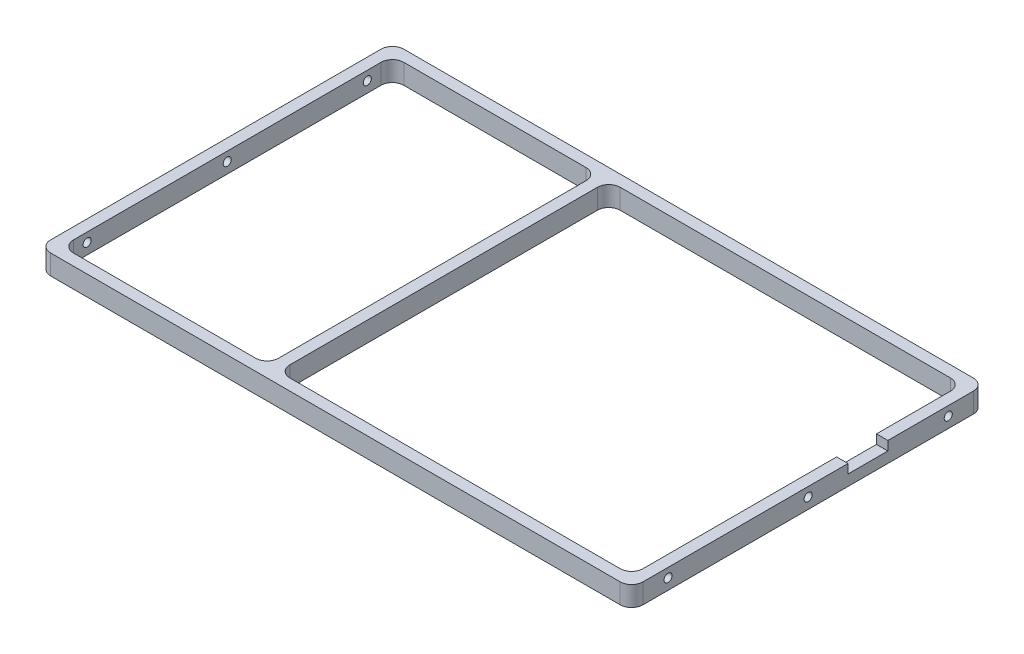
from build123d import *

# Parameters (mm, degrees)
SKETCH1_W                      = 330.2
SKETCH1_H                      = 196.85
BOSS_EXTRUDE1_DEPTH            = 11.1125
SKETCH3_W                      = 317.5
SKETCH3_H                      = 184.15
CUT_EXTRUDE1_DEPTH             = 193.533057632
FILLET1_R                      = 6.35
SKETCH4_W                      = 6.35
SKETCH4_H                      = 11.1125
BOSS_EXTRUDE2_DEPTH            = 184.15
FILLET2_R                      = 6.35
F_8_CLEARANCE_HOLE1_REACH      = 346.736
F_8_CLEARANCE_HOLE1_BORE_R     = 2.2479
F_4_40_TAPPED_HOLE1_AT_2_COUNT = 2
F_4_40_TAPPED_HOLE1_AT_2_PITCH = 57.15
F_4_40_TAPPED_HOLE1_AT_3_COUNT = 2
F_4_40_TAPPED_HOLE1_AT_3_PITCH = 117.475
F_4_40_TAPPED_HOLE1_AT_4_COUNT = 2
F_4_40_TAPPED_HOLE1_AT_4_PITCH = 187.325
F_4_40_TAPPED_HOLE1_AT_5_COUNT = 2
F_4_40_TAPPED_HOLE1_AT_5_PITCH = 247.65
F_4_40_TAPPED_HOLE1_AT_6_COUNT = 2
F_4_40_TAPPED_HOLE1_AT_6_PITCH = 317.5
F_4_40_TAPPED_HOLE2_AT_2_COUNT = 2
F_4_40_TAPPED_HOLE2_AT_2_PITCH = 95.25
LPATTERN1_COUNT                = 2
LPATTERN1_PITCH                = 120.015
CUT_EXTRUDE2_REACH             = 346.736
SKETCH13_W                     = 22.225
SKETCH13_H                     = 5.08


with BuildPart() as part:
    # Sketch1 → Boss-Extrude1 (new body)
    with BuildSketch(Plane(origin=(0, 0, 0), x_dir=(1, 0, 0), z_dir=(0, 1, 0))):
        Rectangle(SKETCH1_W, SKETCH1_H)
    extrude(amount=BOSS_EXTRUDE1_DEPTH)

    # Sketch3 → Cut-Extrude1 (cut, through all)
    with BuildSketch(Plane(origin=(0, 11.1125, 0), x_dir=(1, 0, 0), z_dir=(0, 1, 0))):
        Rectangle(SKETCH3_W, SKETCH3_H)
    extrude(amount=-CUT_EXTRUDE1_DEPTH, mode=Mode.SUBTRACT)

    # Fillet1
    fillet1_edges = [part.edges().sort_by_distance(p)[0] for p in [
        (158.75, 5.55625, -92.075),
        (158.75, 5.55625, 92.075),
        (-158.75, 5.55625, 92.075),
        (-158.75, 5.55625, -92.075),
        (165.1, 5.55625, 98.425),
        (-165.1, 5.55625, 98.425),
        (-165.1, 5.55625, -98.425),
        (165.1, 5.55625, -98.425),
    ]]
    fillet(fillet1_edges, radius=FILLET1_R)

    # Sketch4 → Boss-Extrude2 (add)
    with BuildSketch(Plane.XY.offset(-92.075)):
        with Locations((-41.275, 5.55625)):
            Rectangle(SKETCH4_W, SKETCH4_H)
    extrude(amount=BOSS_EXTRUDE2_DEPTH)

    # Fillet2
    fillet2_edges = [part.edges().sort_by_distance(p)[0] for p in [
        (-44.45, 5.55625, -92.075),
        (-38.1, 5.55625, -92.075),
        (-44.45, 5.55625, 92.075),
        (-38.1, 5.55625, 92.075),
    ]]
    fillet(fillet2_edges, radius=FILLET2_R)

    # #8 Clearance Hole1 bore → #8 Clearance Hole1 (cut, up to next)
    with BuildSketch(Plane.ZY.offset(165.1), mode=Mode.PRIVATE) as f_8_clearance_hole1_sk1:
        with Locations((-78.105, 6.0325)):
            Circle(F_8_CLEARANCE_HOLE1_BORE_R)
    f_8_clearance_hole1_tool1 = extrude(f_8_clearance_hole1_sk1.sketch, amount=-F_8_CLEARANCE_HOLE1_REACH, mode=Mode.PRIVATE) & part.part
    # #8 Clearance Hole1 bore → #8 Clearance Hole1 (cut, up to next)
    with BuildSketch(Plane.ZY.offset(165.1), mode=Mode.PRIVATE) as f_8_clearance_hole1_sk2:
        with Locations((0, 6.0325)):
            Circle(F_8_CLEARANCE_HOLE1_BORE_R)
    f_8_clearance_hole1_tool2 = extrude(f_8_clearance_hole1_sk2.sketch, amount=-F_8_CLEARANCE_HOLE1_REACH, mode=Mode.PRIVATE) & part.part
    # #8 Clearance Hole1 bore → #8 Clearance Hole1 (cut, up to next)
    with BuildSketch(Plane.ZY.offset(165.1), mode=Mode.PRIVATE) as f_8_clearance_hole1_sk3:
        with Locations((78.105, 6.0325)):
            Circle(F_8_CLEARANCE_HOLE1_BORE_R)
    f_8_clearance_hole1_tool3 = extrude(f_8_clearance_hole1_sk3.sketch, amount=-F_8_CLEARANCE_HOLE1_REACH, mode=Mode.PRIVATE) & part.part
    f_8_clearance_hole1_1 = f_8_clearance_hole1_tool1.solids().sort_by_distance((-165.1, 6.0325, -78.105))[0]
    add(f_8_clearance_hole1_1, mode=Mode.SUBTRACT)
    f_8_clearance_hole1_2 = f_8_clearance_hole1_tool2.solids().sort_by_distance((-165.1, 6.0325, 0))[0]
    add(f_8_clearance_hole1_2, mode=Mode.SUBTRACT)
    f_8_clearance_hole1_3 = f_8_clearance_hole1_tool3.solids().sort_by_distance((-165.1, 6.0325, 78.105))[0]
    add(f_8_clearance_hole1_3, mode=Mode.SUBTRACT)
    f_8_clearance_hole1 = f_8_clearance_hole1_1 + f_8_clearance_hole1_2 + f_8_clearance_hole1_3  # #8 Clearance Hole1 as one shape, for the pattern or mirror that repeats it

    # Mirror1: #8 Clearance Hole1 across plane
    add(f_8_clearance_hole1.mirror(Plane(origin=(0, 0, 0), x_dir=(0, 0, 1), z_dir=(1, 0, 0))), mode=Mode.SUBTRACT)

    # Sketch9 → #4-40 Tapped Hole1 (revolve, cut)
    with BuildSketch(Plane(origin=(-158.75, 0, 94.615), x_dir=(0, 0, -1), z_dir=(1, 0, 0))):
        Polygon((0, 0), (0, 8.299152758), (1.1303, 7.62), (1.1303, 0), align=None)
    f_4_40_tapped_hole1 = revolve(axis=Axis((-158.75, -6.35, 94.615), (0, 1, 0)), mode=Mode.SUBTRACT)

    # #4-40 Tapped Hole1 at 2: #4-40 Tapped Hole1 ×2
    with Locations(*[(i * F_4_40_TAPPED_HOLE1_AT_2_PITCH, 0, 0) for i in range(1, F_4_40_TAPPED_HOLE1_AT_2_COUNT)]):
        add(f_4_40_tapped_hole1, mode=Mode.SUBTRACT)

    # #4-40 Tapped Hole1 at 3: #4-40 Tapped Hole1 ×2
    with Locations(*[(i * F_4_40_TAPPED_HOLE1_AT_3_PITCH, 0, 0) for i in range(1, F_4_40_TAPPED_HOLE1_AT_3_COUNT)]):
        add(f_4_40_tapped_hole1, mode=Mode.SUBTRACT)

    # #4-40 Tapped Hole1 at 4: #4-40 Tapped Hole1 ×2
    with Locations(*[(i * F_4_40_TAPPED_HOLE1_AT_4_PITCH, 0, 0) for i in range(1, F_4_40_TAPPED_HOLE1_AT_4_COUNT)]):
        add(f_4_40_tapped_hole1, mode=Mode.SUBTRACT)

    # #4-40 Tapped Hole1 at 5: #4-40 Tapped Hole1 ×2
    with Locations(*[(i * F_4_40_TAPPED_HOLE1_AT_5_PITCH, 0, 0) for i in range(1, F_4_40_TAPPED_HOLE1_AT_5_COUNT)]):
        add(f_4_40_tapped_hole1, mode=Mode.SUBTRACT)

    # #4-40 Tapped Hole1 at 6: #4-40 Tapped Hole1 ×2
    with Locations(*[(i * F_4_40_TAPPED_HOLE1_AT_6_PITCH, 0, 0) for i in range(1, F_4_40_TAPPED_HOLE1_AT_6_COUNT)]):
        add(f_4_40_tapped_hole1, mode=Mode.SUBTRACT)

    # Mirror2: #4-40 Tapped Hole1 across plane
    add(f_4_40_tapped_hole1.mirror(Plane.XY), mode=Mode.SUBTRACT)

    # Mirror2 copy 1 sketch → Mirror2 copy 1 (revolve, cut)
    with BuildSketch(Plane(origin=(-101.6, 0, -94.615), x_dir=(0, 0, 1), z_dir=(1, 0, 0))):
        Polygon((0, 0), (0, -8.299152758), (1.1303, -7.62), (1.1303, 0), align=None)
    revolve(axis=Axis((-101.6, -6.35, -94.615), (0, -1, 0)), mode=Mode.SUBTRACT)

    # Mirror2 copy 2 sketch → Mirror2 copy 2 (revolve, cut)
    with BuildSketch(Plane(origin=(-41.275, 0, -94.615), x_dir=(0, 0, 1), z_dir=(1, 0, 0))):
        Polygon((0, 0), (0, -8.299152758), (1.1303, -7.62), (1.1303, 0), align=None)
    revolve(axis=Axis((-41.275, -6.35, -94.615), (0, -1, 0)), mode=Mode.SUBTRACT)

    # Mirror2 copy 3 sketch → Mirror2 copy 3 (revolve, cut)
    with BuildSketch(Plane(origin=(28.575, 0, -94.615), x_dir=(0, 0, 1), z_dir=(1, 0, 0))):
        Polygon((0, 0), (0, -8.299152758), (1.1303, -7.62), (1.1303, 0), align=None)
    revolve(axis=Axis((28.575, -6.35, -94.615), (0, -1, 0)), mode=Mode.SUBTRACT)

    # Mirror2 copy 4 sketch → Mirror2 copy 4 (revolve, cut)
    with BuildSketch(Plane(origin=(88.9, 0, -94.615), x_dir=(0, 0, 1), z_dir=(1, 0, 0))):
        Polygon((0, 0), (0, -8.299152758), (1.1303, -7.62), (1.1303, 0), align=None)
    revolve(axis=Axis((88.9, -6.35, -94.615), (0, -1, 0)), mode=Mode.SUBTRACT)

    # Mirror2 copy 5 sketch → Mirror2 copy 5 (revolve, cut)
    with BuildSketch(Plane(origin=(158.75, 0, -94.615), x_dir=(0, 0, 1), z_dir=(1, 0, 0))):
        Polygon((0, 0), (0, -8.299152758), (1.1303, -7.62), (1.1303, 0), align=None)
    revolve(axis=Axis((158.75, -6.35, -94.615), (0, -1, 0)), mode=Mode.SUBTRACT)

    # Sketch11 → #4-40 Tapped Hole2 (revolve, cut)
    with BuildSketch(Plane(origin=(-161.29, 0, 47.625), x_dir=(0, 0, -1), z_dir=(1, 0, 0))):
        Polygon((0, 0), (0, 8.299152758), (1.1303, 7.62), (1.1303, 0), align=None)
    f_4_40_tapped_hole2 = revolve(axis=Axis((-161.29, -6.35, 47.625), (0, 1, 0)), mode=Mode.SUBTRACT)

    # #4-40 Tapped Hole2 at 2: #4-40 Tapped Hole2 ×2
    with Locations(*[(0, 0, -i * F_4_40_TAPPED_HOLE2_AT_2_PITCH) for i in range(1, F_4_40_TAPPED_HOLE2_AT_2_COUNT)]):
        add(f_4_40_tapped_hole2, mode=Mode.SUBTRACT)

    # LPattern1: #4-40 Tapped Hole2 ×2
    with Locations(*[(i * LPATTERN1_PITCH, 0, 0) for i in range(1, LPATTERN1_COUNT)]):
        add(f_4_40_tapped_hole2, mode=Mode.SUBTRACT)

    # LPattern1 copy 1 sketch → LPattern1 copy 1 (revolve, cut)
    with BuildSketch(Plane(origin=(-41.275, 0, -47.625), x_dir=(0, 0, -1), z_dir=(1, 0, 0))):
        Polygon((0, 0), (0, 8.299152758), (1.1303, 7.62), (1.1303, 0), align=None)
    revolve(axis=Axis((-41.275, -6.35, -47.625), (0, 1, 0)), mode=Mode.SUBTRACT)

    # Mirror3: #4-40 Tapped Hole2 across plane
    add(f_4_40_tapped_hole2.mirror(Plane(origin=(0, 0, 0), x_dir=(0, 0, 1), z_dir=(1, 0, 0))), mode=Mode.SUBTRACT)

    # Mirror3 copy 1 sketch → Mirror3 copy 1 (revolve, cut)
    with BuildSketch(Plane(origin=(161.29, 0, -47.625), x_dir=(0, 0, -1), z_dir=(-1, 0, 0))):
        Polygon((0, 0), (0, -8.299152758), (1.1303, -7.62), (1.1303, 0), align=None)
    revolve(axis=Axis((161.29, -6.35, -47.625), (0, -1, 0)), mode=Mode.SUBTRACT)

    # Sketch13 → Cut-Extrude2 (cut, up to next)
    with BuildSketch(Plane(origin=(165.1, 0, 0), x_dir=(0, 0, -1), z_dir=(1, 0, 0)), mode=Mode.PRIVATE) as cut_extrude2_sk1:
        with Locations((33.3375, 8.5725)):
            Rectangle(SKETCH13_W, SKETCH13_H)
    cut_extrude2_tool1 = extrude(cut_extrude2_sk1.sketch, amount=-CUT_EXTRUDE2_REACH, mode=Mode.PRIVATE) & part.part
    add(cut_extrude2_tool1.solids().sort_by_distance((165.1, 8.5725, -33.3375))[0], mode=Mode.SUBTRACT)


solid = part.part
